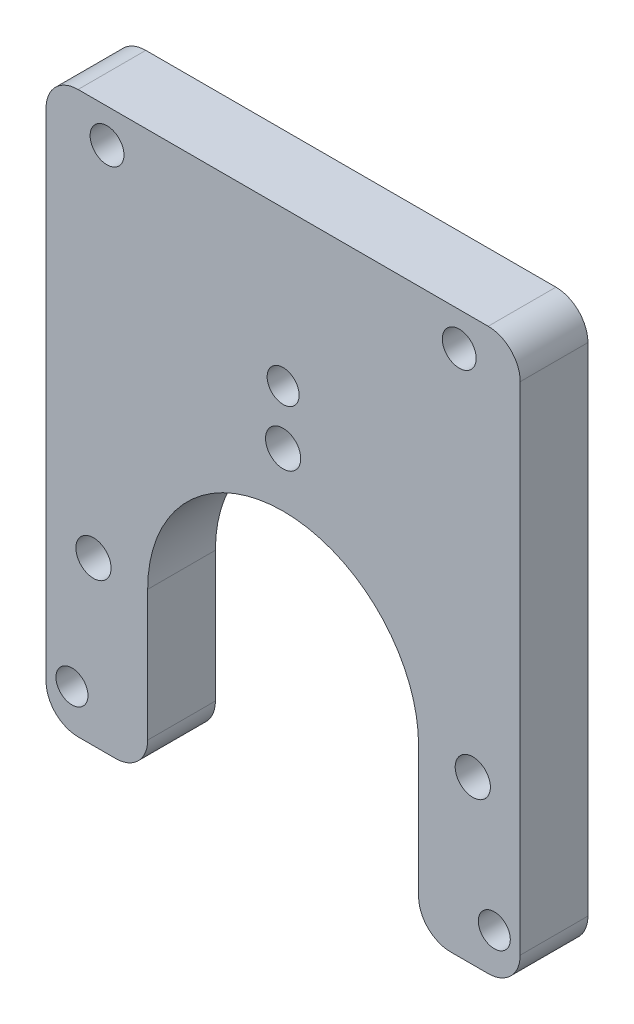
from build123d import *

# Parameters (mm, degrees)
SKETCH1_R           = 1.5875
SKETCH1_R_2         = 1.65
SKETCH1_R_3         = 1.5
BOSS_EXTRUDE1_DEPTH = 6.35
FILLET1_R           = 3


with BuildPart() as part:
    # Sketch1 → Boss-Extrude1 (new body)
    with BuildSketch(Plane.XY):
        with BuildLine():
            Line((0, 0), (9.525, 0))
            Line((9.525, 0), (9.525, 15.24))
            ThreePointArc((9.525, 15.24), (22.225, 27.94), (34.925, 15.24))
            Line((34.925, 15.24), (34.925, 0))
            Line((34.925, 0), (44.45, 0))
            Line((44.45, 0), (44.45, 52.563))
            Line((44.45, 52.563), (0, 52.563))
            Line((0, 52.563), (0, 0))
        make_face()
        with Locations((5.715, 49.388)):
            Circle(SKETCH1_R, mode=Mode.SUBTRACT)
        with Locations((38.735, 49.388)):
            Circle(SKETCH1_R, mode=Mode.SUBTRACT)
        with Locations((4.445, 15.24)):
            Circle(SKETCH1_R_2, mode=Mode.SUBTRACT)
        with Locations((22.225, 33.02)):
            Circle(SKETCH1_R_2, mode=Mode.SUBTRACT)
        with Locations((40.005, 15.24)):
            Circle(SKETCH1_R_2, mode=Mode.SUBTRACT)
        with Locations((22.225, 38.1)):
            Circle(SKETCH1_R_3, mode=Mode.SUBTRACT)
        with Locations((42.022340731, 3.81)):
            Circle(SKETCH1_R_3, mode=Mode.SUBTRACT)
        with Locations((2.427659269, 3.81)):
            Circle(SKETCH1_R_3, mode=Mode.SUBTRACT)
    extrude(amount=BOSS_EXTRUDE1_DEPTH)

    # Fillet1
    fillet1_edges = [part.edges().sort_by_distance(p)[0] for p in [
        (9.525, 0, 3.175),
        (0, 0, 3.175),
        (0, 52.563, 3.175),
        (44.45, 52.563, 3.175),
        (44.45, 0, 3.175),
        (34.925, 0, 3.175),
    ]]
    fillet(fillet1_edges, radius=FILLET1_R)


solid = part.part
